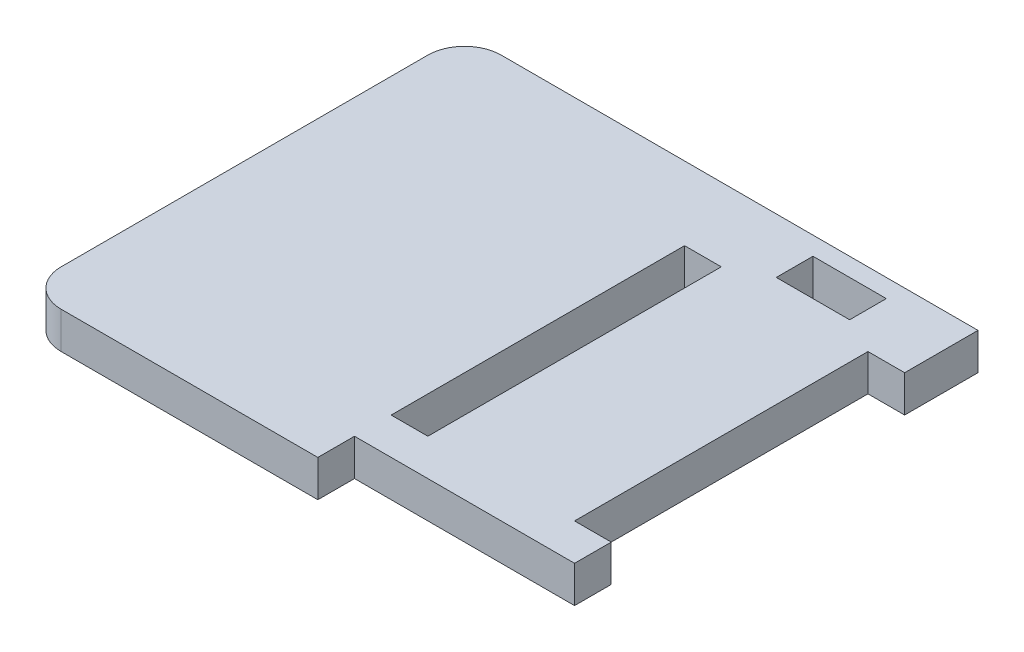
from build123d import *

# Parameters (mm, degrees)
BOSS_EXTRUDE1_DEPTH = 3.175
SKETCH2_W           = 6.35
SKETCH2_H           = 50.8
SKETCH2_W_2         = 38.1
SKETCH2_H_2         = 6.35
SKETCH2_W_3         = 12.7
CUT_EXTRUDE1_DEPTH  = 59.887477446


with BuildPart() as part:
    # Sketch1 → Boss-Extrude1 (new, symmetric)
    with BuildSketch(Plane(origin=(0, 0, 0), x_dir=(1, 0, 0), z_dir=(0, 1, 0))):
        with BuildLine():
            Line((44.45, -38.1), (-38.1, -38.1))
            ThreePointArc((-38.1, -38.1), (-42.590128061, -36.240128061), (-44.45, -31.75))
            Line((-44.45, -31.75), (-44.45, 31.75))
            ThreePointArc((-44.45, 31.75), (-42.590128061, 36.240128061), (-38.1, 38.1))
            Line((-38.1, 38.1), (44.45, 38.1))
            Line((44.45, 38.1), (44.45, -38.1))
        make_face()
    extrude(amount=BOSS_EXTRUDE1_DEPTH, both=True)

    # Sketch2 → Cut-Extrude1 (cut, through all)
    with BuildSketch(Plane.XZ.offset(3.175)):
        with Locations((41.275, 0)):
            Rectangle(SKETCH2_W, SKETCH2_H)
        with Locations((25.4, 34.925)):
            Rectangle(SKETCH2_W_2, SKETCH2_H_2)
        with Locations((9.525, 0)):
            Rectangle(SKETCH2_W, SKETCH2_H)
        with Locations((25.4, -31.75)):
            Rectangle(SKETCH2_W_3, SKETCH2_H_2)
    extrude(amount=-CUT_EXTRUDE1_DEPTH, mode=Mode.SUBTRACT)


solid = part.part
